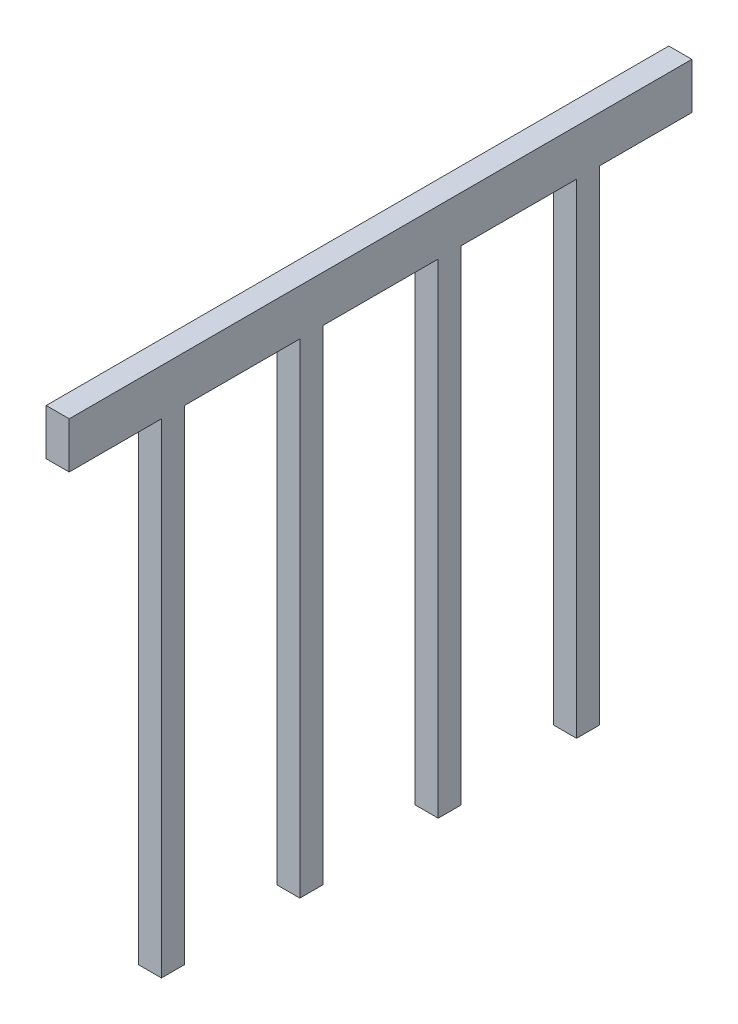
from build123d import *

# Parameters (mm, degrees)
BOSS_EXTRUDE1_DEPTH = 25.4


with BuildPart() as part:
    # Sketch3 → Boss-Extrude1 (new body)
    with BuildSketch(Plane(origin=(0, 0, 0), x_dir=(0, 0, -1), z_dir=(1, 0, 0))):
        Polygon((-342.9, 584.2), (342.9, 584.2), (342.9, 533.4), (241.3, 533.4), (241.3, 0), (215.9, 0), (215.9, 533.4), (88.9, 533.4), (88.9, 0), (63.5, 0), (63.5, 533.4), (-63.5, 533.4), (-63.5, 0), (-88.9, 0), (-88.9, 533.4), (-215.9, 533.4), (-215.9, 0), (-241.3, 0), (-241.3, 533.4), (-342.9, 533.4), align=None)
    extrude(amount=BOSS_EXTRUDE1_DEPTH)


solid = part.part
